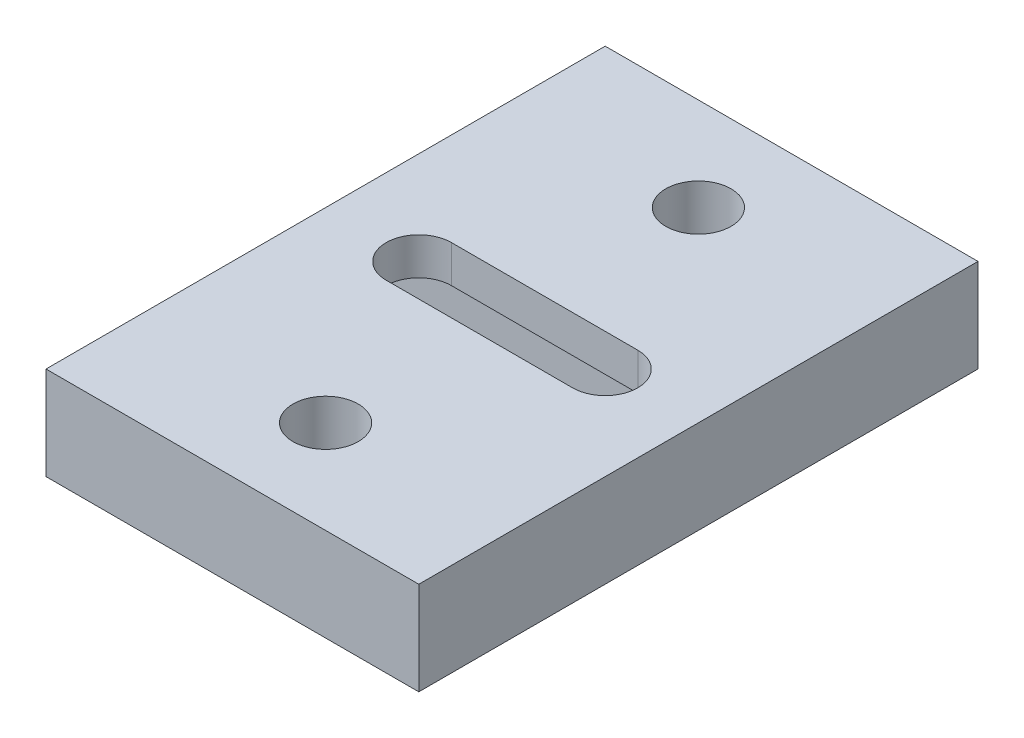
from build123d import *

# Parameters (mm, degrees)
SKETCH1_W           = 20
SKETCH1_H           = 30
BOSS_EXTRUDE1_DEPTH = 5
CUT_EXTRUDE1_DEPTH  = 8
SKETCH3_R           = 1.75
CUT_EXTRUDE2_DEPTH  = 37.400549446
SKETCH4_W           = 5.7
SKETCH4_H           = 3
CUT_EXTRUDE3_DEPTH  = 18


with BuildPart() as part:
    # Sketch1 → Boss-Extrude1 (new body)
    with BuildSketch(Plane(origin=(0, 0, 0), x_dir=(1, 0, 0), z_dir=(0, 1, 0))):
        with Locations((10, 15)):
            Rectangle(SKETCH1_W, SKETCH1_H)
    extrude(amount=BOSS_EXTRUDE1_DEPTH)

    # Sketch2 → Cut-Extrude1 (cut)
    with BuildSketch(Plane(origin=(0, 5, 0), x_dir=(1, 0, 0), z_dir=(0, 1, 0))):
        with BuildLine():
            Line((5, 16.75), (15, 16.75))
            ThreePointArc((15, 16.75), (16.75, 15), (15, 13.25))
            Line((15, 13.25), (5, 13.25))
            ThreePointArc((5, 13.25), (3.25, 15), (5, 16.75))
        make_face()
    extrude(amount=-CUT_EXTRUDE1_DEPTH, mode=Mode.SUBTRACT)

    # Sketch3 → Cut-Extrude2 (cut, through all)
    with BuildSketch(Plane(origin=(0, 5, 0), x_dir=(1, 0, 0), z_dir=(0, 1, 0))):
        with Locations(Location((10, 25, 0), (0, 0, 270))):
            Circle(SKETCH3_R)
        with Locations(Location((10, 5, 0), (0, 0, 270))):
            Circle(SKETCH3_R)
    extrude(amount=-CUT_EXTRUDE2_DEPTH, mode=Mode.SUBTRACT)

    # Sketch4 → Cut-Extrude3 (cut)
    with BuildSketch(Plane.ZY):
        with Locations((-15.15, 1.5)):
            Rectangle(SKETCH4_W, SKETCH4_H)
    extrude(amount=-CUT_EXTRUDE3_DEPTH, mode=Mode.SUBTRACT)


solid = part.part
